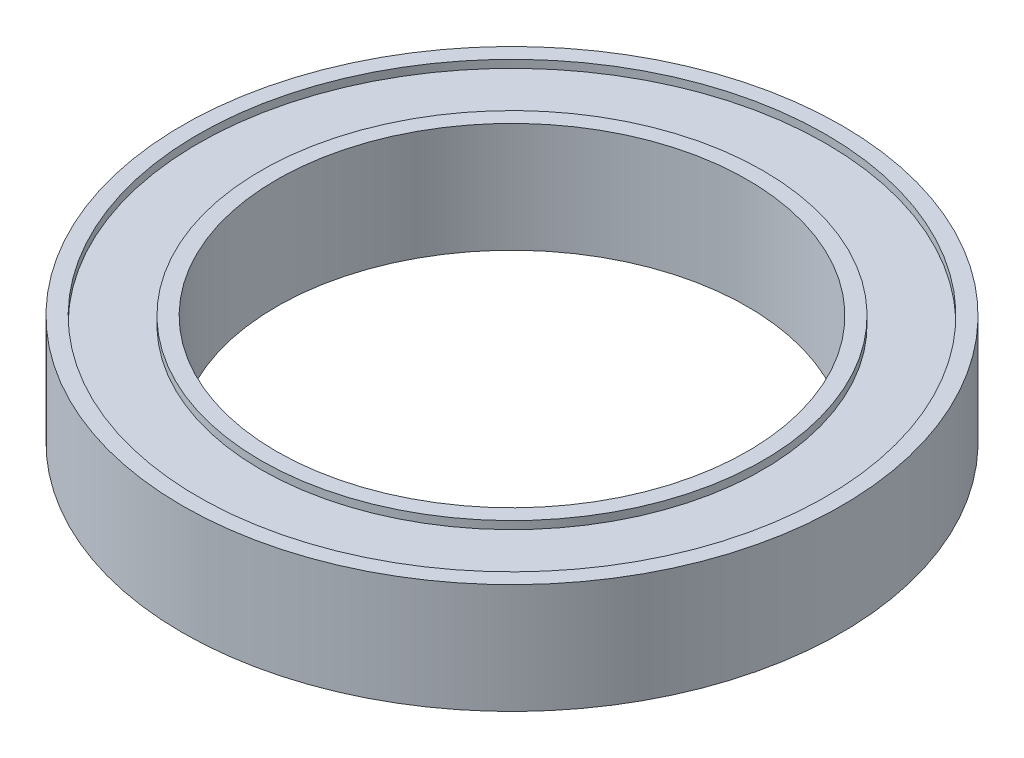
from build123d import *

# Parameters (mm, degrees)
SKETCH1_R           = 21
SKETCH1_R_2         = 15
BOSS_EXTRUDE1_DEPTH = 3.5
CUT_EXTRUDE1_START  = -0.5
SKETCH2_R           = 20
SKETCH2_R_2         = 16
CUT_EXTRUDE1_DEPTH  = 32.012292605


with BuildPart() as part:
    # Sketch1 → Boss-Extrude1 (new, symmetric)
    with BuildSketch(Plane(origin=(0, 0, 0), x_dir=(1, 0, 0), z_dir=(0, 1, 0))):
        with Locations(Location((0, 0, 0), (0, 0, 270))):
            Circle(SKETCH1_R)
        with Locations(Location((0, 0, 0), (0, 0, 270))):
            Circle(SKETCH1_R_2, mode=Mode.SUBTRACT)
    extrude(amount=BOSS_EXTRUDE1_DEPTH, both=True)

    # Sketch2 → Cut-Extrude1 (cut)
    with BuildSketch(Plane(origin=(0, 3.5, 0), x_dir=(1, 0, 0), z_dir=(0, 1, 0)).offset(CUT_EXTRUDE1_START)):
        with Locations(Location((0, 0, 0), (0, 0, 90))):
            Circle(SKETCH2_R)
        with Locations(Location((0, 0, 0), (0, 0, 90))):
            Circle(SKETCH2_R_2, mode=Mode.SUBTRACT)
    cut_extrude1 = extrude(amount=CUT_EXTRUDE1_DEPTH, mode=Mode.SUBTRACT)

    # Mirror1: Cut-Extrude1 across plane
    add(cut_extrude1.mirror(Plane.ZX), mode=Mode.SUBTRACT)


solid = part.part
